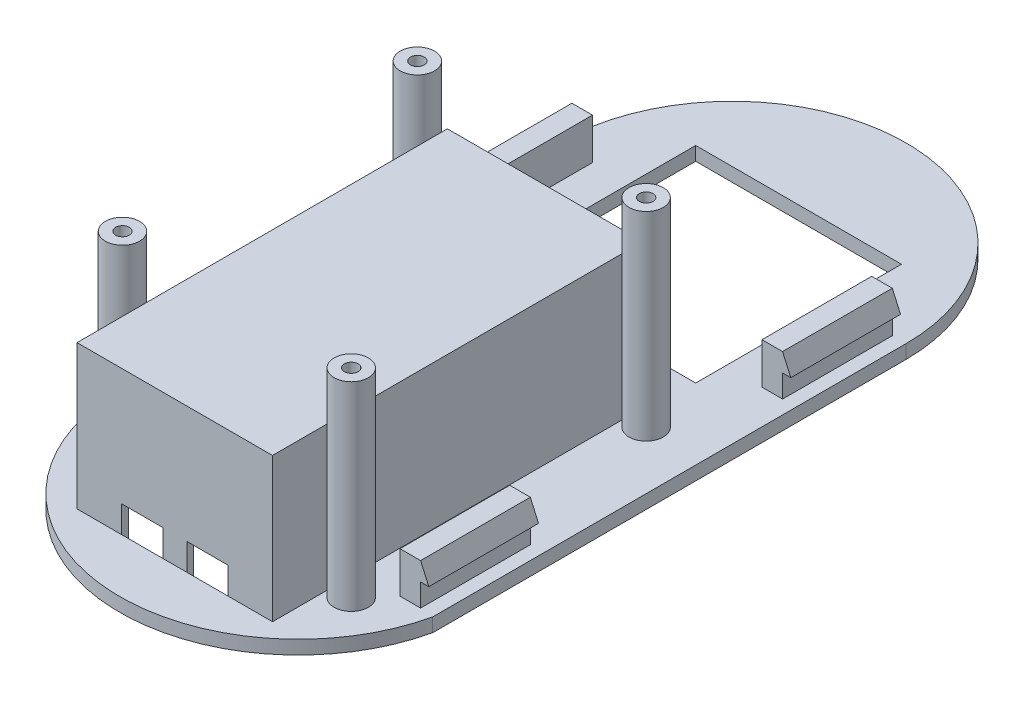
from build123d import *

# Parameters (mm, degrees)
SALIENTE_EXTRUIR1_DEPTH    = 2
CROQUIS3_W                 = 28.5
CROQUIS3_H                 = 54
SALIENTE_EXTRUIR2_DEPTH    = 21
CORTAR_EXTRUIR2_DEPTH      = 21
CORTAR_EXTRUIR2_DEPTH_BACK = 61
CORTAR_EXTRUIR2_START      = -23
CROQUIS7_W                 = 26.5
CROQUIS7_H                 = 52
CROQUIS10_W                = 18.5
CROQUIS10_H                = 13
CORTAR_EXTRUIR3_DEPTH      = 10
CROQUIS11_W                = 28.5
CROQUIS11_H                = 54
CORTAR_EXTRUIR4_DEPTH      = 0.9
CROQUIS12_W                = 30
CROQUIS12_H                = 30
CORTAR_EXTRUIR6_DEPTH      = 20.6
CROQUIS13_W                = 3
CROQUIS13_H                = 16
SALIENTE_EXTRUIR5_DEPTH    = 6
SALIENTE_EXTRUIR9_DEPTH    = 16
SALIENTE_EXTRUIR10_DEPTH   = 16
SALIENTE_EXTRUIR11_DEPTH   = 16
SALIENTE_EXTRUIR12_DEPTH   = 16
CROQUIS25_W                = 4.5
CROQUIS25_H                = 1.45
CORTAR_EXTRUIR7_DEPTH      = 0.9
CORTAR_EXTRUIR9_DEPTH      = 0.9
CORTAR_EXTRUIR9_DEPTH_BACK = 1
CROQUIS26_W                = 6
CROQUIS26_H                = 5
CROQUIS32_R                = 2.5
SALIENTE_EXTRUIR13_DEPTH   = 29
CROQUIS36_R                = 1
CORTAR_EXTRUIR10_DEPTH     = 4.5
CROQUIS39_R                = 1
CORTAR_EXTRUIR11_DEPTH     = 4.5
CROQUIS38_R                = 1
CORTAR_EXTRUIR12_DEPTH     = 4.5
CROQUIS37_R                = 1
CORTAR_EXTRUIR13_DEPTH     = 4.5


with BuildPart() as part:
    # Croquis1 → Saliente-Extruir1 (new body)
    with BuildSketch(Plane(origin=(0, 0, 0), x_dir=(1, 0, 0), z_dir=(0, 1, 0))):
        with BuildLine():
            Line((-76.52774776, -47.188914739), (-76.52774776, 21.977990865))
            ThreePointArc((-76.52774776, 21.977990865), (-51.168030611, 47.337708015), (-25.808313462, 21.977990865))
            Line((-25.808313462, 21.977990865), (-25.808313462, -47.033075243))
            ThreePointArc((-25.808313462, -47.033075243), (-51.106035712, -67.287819919), (-76.52774776, -47.188914739))
        make_face()
    extrude(amount=SALIENTE_EXTRUIR1_DEPTH)

    # Croquis3 → Saliente-Extruir2 (add)
    with BuildSketch(Plane(origin=(0, 2, 0), x_dir=(1, 0, 0), z_dir=(0, 1, 0))):
        with Locations((-51.124943413, -32.32840731)):
            Rectangle(CROQUIS3_W, CROQUIS3_H)
    extrude(amount=SALIENTE_EXTRUIR2_DEPTH)

    # Croquis7 → Cortar-Extruir2 (cut, two sides: drawn at the far end of the back side and taken through both)
    with BuildSketch(Plane(origin=(0, 23, 0), x_dir=(1, 0, 0), z_dir=(0, 1, 0)).offset(CORTAR_EXTRUIR2_START - CORTAR_EXTRUIR2_DEPTH_BACK)):
        with Locations((-51.124943413, -32.32840731)):
            Rectangle(CROQUIS7_W, CROQUIS7_H)
    extrude(amount=CORTAR_EXTRUIR2_DEPTH + CORTAR_EXTRUIR2_DEPTH_BACK, mode=Mode.SUBTRACT)

    # Croquis10 → Cortar-Extruir3 (cut)
    with BuildSketch(Plane(origin=(0, 0, 5.32840731), x_dir=(-1, 0, 0), z_dir=(0, 0, -1))):
        with Locations((51.124943413, 8.5)):
            Rectangle(CROQUIS10_W, CROQUIS10_H)
    extrude(amount=-CORTAR_EXTRUIR3_DEPTH, mode=Mode.SUBTRACT)

    # Croquis11 → Cortar-Extruir4 (cut)
    with BuildSketch(Plane.XZ):
        with Locations((-51.124943413, 32.32840731)):
            Rectangle(CROQUIS11_W, CROQUIS11_H)
    extrude(amount=-CORTAR_EXTRUIR4_DEPTH, mode=Mode.SUBTRACT)

    # Croquis12 → Cortar-Extruir6 (cut)
    with BuildSketch(Plane(origin=(0, 2, 0), x_dir=(1, 0, 0), z_dir=(0, 1, 0))):
        with Locations((-51.168030611, 16.67159269)):
            Rectangle(CROQUIS12_W, CROQUIS12_H)
    extrude(amount=-CORTAR_EXTRUIR6_DEPTH, mode=Mode.SUBTRACT)

    # Croquis13 → Saliente-Extruir5 (add)
    with BuildSketch(Plane(origin=(0, 2, 0), x_dir=(1, 0, 0), z_dir=(0, 1, 0))):
        with Locations((-29.308313462, -38.804003852)):
            Rectangle(CROQUIS13_W, CROQUIS13_H)
        with Locations((-73.02774776, -38.95348914)):
            Rectangle(CROQUIS13_W, CROQUIS13_H)
        with Locations((-73.02774776, 13.977990865)):
            Rectangle(CROQUIS13_W, CROQUIS13_H)
        with Locations((-29.308313462, 13.977990865)):
            Rectangle(CROQUIS13_W, CROQUIS13_H)
    extrude(amount=SALIENTE_EXTRUIR5_DEPTH)

    # Croquis18 → Saliente-Extruir9 (add)
    with BuildSketch(Plane.XY.offset(46.804003852)):
        Polygon((-27.808313462, 8), (-27.808313462, 5.3), (-26.608313462, 5.3), align=None)
    extrude(amount=-SALIENTE_EXTRUIR9_DEPTH)

    # Croquis21 → Saliente-Extruir10 (add)
    with BuildSketch(Plane.XY.offset(46.95348914)):
        Polygon((-74.52774776, 8), (-74.52774776, 5.3), (-75.72774776, 5.3), align=None)
    extrude(amount=-SALIENTE_EXTRUIR10_DEPTH)

    # Croquis22 → Saliente-Extruir11 (add)
    with BuildSketch(Plane(origin=(0, 0, -21.977990865), x_dir=(-1, 0, 0), z_dir=(0, 0, -1))):
        Polygon((27.808313462, 8), (27.808313462, 5.3), (26.608313462, 5.3), align=None)
    extrude(amount=-SALIENTE_EXTRUIR11_DEPTH)

    # Croquis23 → Saliente-Extruir12 (add)
    with BuildSketch(Plane(origin=(0, 0, -21.977990865), x_dir=(-1, 0, 0), z_dir=(0, 0, -1))):
        Polygon((74.52774776, 8), (74.52774776, 5.3), (75.72774776, 5.3), align=None)
    extrude(amount=-SALIENTE_EXTRUIR12_DEPTH)

    # Croquis25 → Cortar-Extruir7 (cut)
    with BuildSketch(Plane.XZ):
        with Locations((-53.374943413, 4.60340731)):
            Rectangle(CROQUIS25_W, CROQUIS25_H)
    extrude(amount=-CORTAR_EXTRUIR7_DEPTH, mode=Mode.SUBTRACT)

    # Croquis26 → Cortar-Extruir9 (cut, two sides: drawn at the far end of the back side and taken through both)
    with BuildSketch(Plane(origin=(0, 0, 58.32840731), x_dir=(-1, 0, 0), z_dir=(0, 0, -1)).offset(-CORTAR_EXTRUIR9_DEPTH_BACK)):
        with Locations((55.874943413, 3.4)):
            Rectangle(CROQUIS26_W, CROQUIS26_H)
        with Locations((46.374943413, 3.4)):
            Rectangle(CROQUIS26_W, CROQUIS26_H)
    extrude(amount=CORTAR_EXTRUIR9_DEPTH + CORTAR_EXTRUIR9_DEPTH_BACK, mode=Mode.SUBTRACT)

    # Croquis32 → Saliente-Extruir13 (add)
    with BuildSketch(Plane(origin=(0, 2, 0), x_dir=(1, 0, 0), z_dir=(0, 1, 0))):
        with Locations(Location((-68.12774776, -49.95348914, 0), (0, 0, 90))):
            Circle(CROQUIS32_R)
        with Locations(Location((-68.12774776, -6.95348914, 0), (0, 0, 90))):
            Circle(CROQUIS32_R)
        with Locations(Location((-34.208313462, -50.515469487, 0), (0, 0, 90))):
            Circle(CROQUIS32_R)
        with Locations(Location((-34.208313462, -7.515469487, 0), (0, 0, 90))):
            Circle(CROQUIS32_R)
    extrude(amount=SALIENTE_EXTRUIR13_DEPTH)

    # Croquis36 → Cortar-Extruir10 (cut)
    with BuildSketch(Plane(origin=(0, 31, 0), x_dir=(1, 0, 0), z_dir=(0, 1, 0))):
        with Locations(Location((-68.12774776, -6.95348914, 0), (0, 0, 270))):
            Circle(CROQUIS36_R)
    extrude(amount=-CORTAR_EXTRUIR10_DEPTH, mode=Mode.SUBTRACT)

    # Croquis39 → Cortar-Extruir11 (cut)
    with BuildSketch(Plane(origin=(0, 31, 0), x_dir=(1, 0, 0), z_dir=(0, 1, 0))):
        with Locations(Location((-68.12774776, -49.95348914, 0), (0, 0, 270))):
            Circle(CROQUIS39_R)
    extrude(amount=-CORTAR_EXTRUIR11_DEPTH, mode=Mode.SUBTRACT)

    # Croquis38 → Cortar-Extruir12 (cut)
    with BuildSketch(Plane(origin=(0, 31, 0), x_dir=(1, 0, 0), z_dir=(0, 1, 0))):
        with Locations(Location((-34.208313462, -50.515469487, 0), (0, 0, 270))):
            Circle(CROQUIS38_R)
    extrude(amount=-CORTAR_EXTRUIR12_DEPTH, mode=Mode.SUBTRACT)

    # Croquis37 → Cortar-Extruir13 (cut)
    with BuildSketch(Plane(origin=(0, 31, 0), x_dir=(1, 0, 0), z_dir=(0, 1, 0))):
        with Locations(Location((-34.208313462, -7.515469487, 0), (0, 0, 270))):
            Circle(CROQUIS37_R)
    extrude(amount=-CORTAR_EXTRUIR13_DEPTH, mode=Mode.SUBTRACT)


solid = part.part
